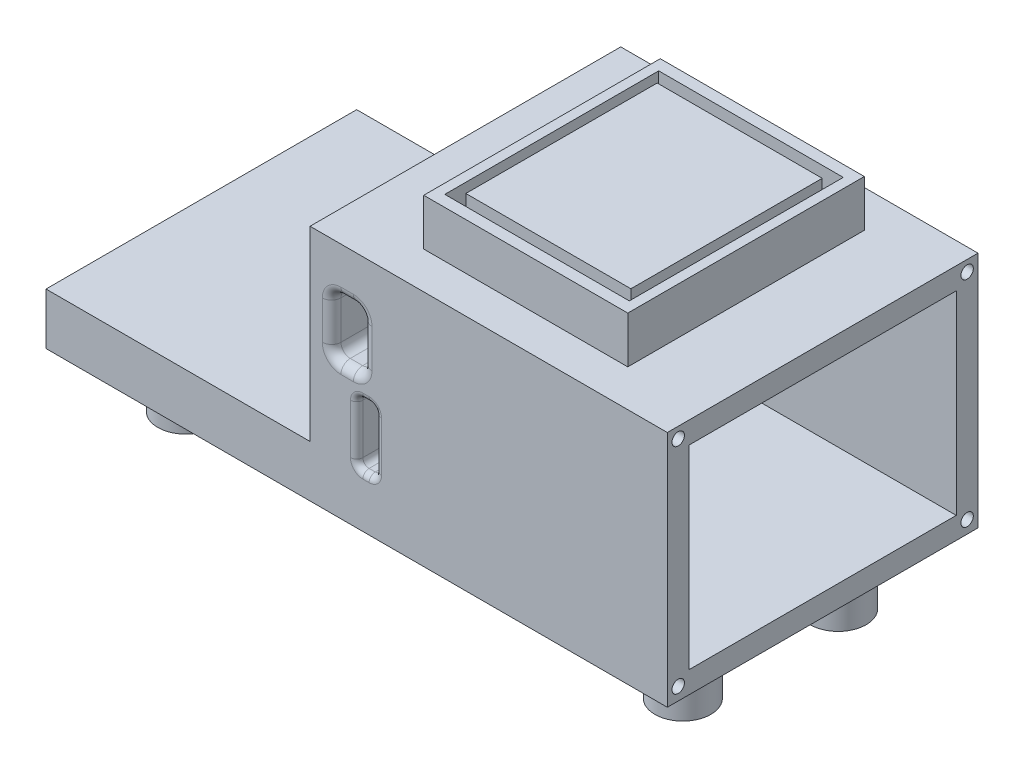
from build123d import *

# Parameters (mm, degrees)
SKETCH1_W            = 115
SKETCH1_H            = 100
BOSS_EXTRUDE1_DEPTH  = 40
SKETCH8_R            = 7
SKETCH8_R_2          = 6
BOSS_EXTRUDE4_DEPTH  = 20
SKETCH9_W            = 200
SKETCH9_H            = 100
BOSS_EXTRUDE5_DEPTH  = 16.6
SKETCH10_R           = 9
SKETCH10_R_2         = 10
BOSS_EXTRUDE7_DEPTH  = 20
SKETCH17_W           = 15
SKETCH17_H           = 100
BOSS_EXTRUDE15_DEPTH = 20
SKETCH15_R           = 14.1
CUT_EXTRUDE2_DEPTH   = 10
SKETCH21_R           = 1.76744544
SKETCH21_R_2         = 2.038433248
CUT_EXTRUDE3_DEPTH   = 20
SKETCH19_R           = 1.6
CUT_EXTRUDE4_DEPTH   = 23
CUT_EXTRUDE5_DEPTH   = 3
SKETCH28_W           = 94
SKETCH28_H           = 100
BOSS_EXTRUDE16_DEPTH = 20
SKETCH11_W           = 65.68
SKETCH11_H           = 76.14
SKETCH11_W_2         = 59.4
SKETCH11_H_2         = 68.859866018
SKETCH11_W_3         = 53.12
SKETCH11_H_3         = 61.579732034
BOSS_EXTRUDE17_DEPTH = 15
SKETCH30_W           = 86
SKETCH30_H           = 62.6
CUT_EXTRUDE10_DEPTH  = 89
SKETCH35_W           = 3
SKETCH35_H           = 15
SKETCH35_W_2         = 15
SKETCH35_H_2         = 3
CUT_EXTRUDE14_DEPTH  = 3
SKETCH36_W           = 10
SKETCH36_H           = 18.374860306
CUT_EXTRUDE15_DEPTH  = 168
SKETCH38_W           = 43.115865236
SKETCH38_H           = 20
BOSS_EXTRUDE18_DEPTH = 10
SKETCH39_W           = 36
SKETCH39_H           = 18.374860306
BOSS_EXTRUDE19_DEPTH = 10
CUT_EXTRUDE16_DEPTH  = 3
FILLET1_R            = 3
FILLET12_R           = 2
FILLET13_R           = 2
SKETCH41_R           = 2
CUT_EXTRUDE17_DEPTH  = 10


with BuildPart() as part:
    # Sketch1 → Boss-Extrude1 (new body)
    with BuildSketch(Plane(origin=(0, 0, 0), x_dir=(1, 0, 0), z_dir=(0, 1, 0))):
        Rectangle(SKETCH1_W, SKETCH1_H)
    extrude(amount=BOSS_EXTRUDE1_DEPTH)

    # Sketch8 → Boss-Extrude4 (add)
    with BuildSketch(Plane.XZ):
        with Locations(Location((0, 0, 0), (0, 0, 90))):
            Circle(SKETCH8_R)
        with Locations(Location((42.407889557, -36.876425702, 0), (0, 0, 90))):
            Circle(SKETCH8_R_2)
        with Locations(Location((42.407889557, 36.876425702, 0), (0, 0, 90))):
            Circle(SKETCH8_R_2)
    extrude(amount=BOSS_EXTRUDE4_DEPTH)

    # Sketch9 → Boss-Extrude5 (add)
    with BuildSketch(Plane.XZ.offset(20)):
        with Locations((-42.5, 0)):
            Rectangle(SKETCH9_W, SKETCH9_H)
    extrude(amount=BOSS_EXTRUDE5_DEPTH)

    # Sketch10 → Boss-Extrude7 (add)
    with BuildSketch(Plane.XZ.offset(36.6)):
        with Locations(Location((37.5, -25, 0), (0, 0, 270))):
            Circle(SKETCH10_R)
        with Locations(Location((-122.5, -25, 0), (0, 0, 90))):
            Circle(SKETCH10_R)
        with Locations(Location((-122.5, 25, 0), (0, 0, 270))):
            Circle(SKETCH10_R)
        with Locations(Location((37.5, 25, 0), (0, 0, 90))):
            Circle(SKETCH10_R)
        with Locations(Location((-42.5, 0, 0), (0, 0, 270))):
            Circle(SKETCH10_R_2)
    extrude(amount=BOSS_EXTRUDE7_DEPTH)

    # Sketch17 → Boss-Extrude15 (add)
    with BuildSketch(Plane.XZ):
        with Locations((-50, 0)):
            Rectangle(SKETCH17_W, SKETCH17_H)
    extrude(amount=BOSS_EXTRUDE15_DEPTH)

    # Sketch15 → Cut-Extrude2 (cut)
    with BuildSketch(Plane(origin=(0, -20, 0), x_dir=(1, 0, 0), z_dir=(0, 1, 0))):
        with Locations(Location((-78.6, 0, 0), (0, 0, 270))):
            Circle(SKETCH15_R)
    extrude(amount=-CUT_EXTRUDE2_DEPTH, mode=Mode.SUBTRACT)

    # Sketch21 → Cut-Extrude3 (cut)
    with BuildSketch(Plane(origin=(0, -30, 0), x_dir=(1, 0, 0), z_dir=(0, 1, 0))):
        with Locations(Location((-85.16065049, 0, 0), (0, 0, 270))):
            Circle(SKETCH21_R)
        with Locations(Location((-73.222056531, 0, 0), (0, 0, 270))):
            Circle(SKETCH21_R_2)
    extrude(amount=-CUT_EXTRUDE3_DEPTH, mode=Mode.SUBTRACT)

    # Sketch19 → Cut-Extrude4 (cut)
    with BuildSketch(Plane.ZY.offset(57.5)):
        with Locations((-32.14, -13.409140004)):
            Circle(SKETCH19_R)
        with Locations((32.14, -13.409140004)):
            Circle(SKETCH19_R)
        with Locations((-32.14, 14.690859996)):
            Circle(SKETCH19_R)
        with Locations(Location((32.14, 14.690859996, 0), (0, 0, 180))):
            Circle(SKETCH19_R)
    extrude(amount=-CUT_EXTRUDE4_DEPTH, mode=Mode.SUBTRACT)

    # Sketch22 → Cut-Extrude5 (cut)
    with BuildSketch(Plane(origin=(-42.5, 0, 0), x_dir=(0, 0, -1), z_dir=(1, 0, 0))):
        Polygon((-28.38722325, -13.409140004), (-30.263611625, -10.159140004), (-34.016388375, -10.159140004), (-35.89277675, -13.409140004), (-34.016388375, -16.659140004), (-30.263611625, -16.659140004), align=None)
        Polygon((30.263611625, -16.659140004), (28.38722325, -13.409140004), (30.263611625, -10.159140004), (34.016388375, -10.159140004), (35.89277675, -13.409140004), (34.016388375, -16.659140004), align=None)
    extrude(amount=-CUT_EXTRUDE5_DEPTH, mode=Mode.SUBTRACT)

    # Sketch28 → Boss-Extrude16 (add)
    with BuildSketch(Plane.XZ):
        with Locations((10.5, 0)):
            Rectangle(SKETCH28_W, SKETCH28_H)
    extrude(amount=BOSS_EXTRUDE16_DEPTH)

    # Sketch11 → Boss-Extrude17 (add)
    # profile 1 of 2: a face of its own
    with BuildSketch(Plane(origin=(0, 40, 0), x_dir=(1, 0, 0), z_dir=(0, 1, 0))):
        Rectangle(SKETCH11_W, SKETCH11_H)
        Rectangle(SKETCH11_W_2, SKETCH11_H_2, mode=Mode.SUBTRACT)
    # profile 2 of 2: a face of its own
    with BuildSketch(Plane(origin=(0, 40, 0), x_dir=(1, 0, 0), z_dir=(0, 1, 0))):
        Rectangle(SKETCH11_W_3, SKETCH11_H_3)
    extrude(amount=BOSS_EXTRUDE17_DEPTH)

    # Sketch30 → Cut-Extrude10 (cut)
    with BuildSketch(Plane(origin=(57.5, 0, 0), x_dir=(0, 0, -1), z_dir=(1, 0, 0))):
        with Locations((0, 1.7)):
            Rectangle(SKETCH30_W, SKETCH30_H)
    extrude(amount=-CUT_EXTRUDE10_DEPTH, mode=Mode.SUBTRACT)

    # Sketch35 → Cut-Extrude14 (cut)
    with BuildSketch(Plane(origin=(0, 40, 0), x_dir=(1, 0, 0), z_dir=(0, 1, 0))):
        with Locations((-28.2, -14.929933009)):
            Rectangle(SKETCH35_W, SKETCH35_H)
        with Locations((-28.2, 15.109933009)):
            Rectangle(SKETCH35_W, SKETCH35_H)
        with Locations((28.2, 15.109933009)):
            Rectangle(SKETCH35_W, SKETCH35_H)
        with Locations((28.2, -14.929933009)):
            Rectangle(SKETCH35_W, SKETCH35_H)
        with Locations((-15.2, -32.639866017)):
            Rectangle(SKETCH35_W_2, SKETCH35_H_2)
        with Locations((15.2, -32.639866017)):
            Rectangle(SKETCH35_W_2, SKETCH35_H_2)
        with Locations((15.2, 32.639866017)):
            Rectangle(SKETCH35_W_2, SKETCH35_H_2)
        with Locations((-15.2, 32.639866017)):
            Rectangle(SKETCH35_W_2, SKETCH35_H_2)
    extrude(amount=-CUT_EXTRUDE14_DEPTH, mode=Mode.SUBTRACT)

    # Sketch36 → Cut-Extrude15 (cut)
    with BuildSketch(Plane.XY.offset(50)):
        with Locations((-45.561490263, 15.812569847)):
            Rectangle(SKETCH36_W, SKETCH36_H)
    extrude(amount=-CUT_EXTRUDE15_DEPTH, mode=Mode.SUBTRACT)

    # Sketch38 → Boss-Extrude18 (add)
    with BuildSketch(Plane(origin=(-42.5, 0, 0), x_dir=(0, 0, -1), z_dir=(1, 0, 0))):
        with Locations((0, -10)):
            Rectangle(SKETCH38_W, SKETCH38_H)
    extrude(amount=BOSS_EXTRUDE18_DEPTH)

    # Sketch39 → Boss-Extrude19 (add)
    with BuildSketch(Plane(origin=(-50.561490263, 0, 0), x_dir=(0, 0, -1), z_dir=(1, 0, 0))):
        with Locations((0, 15.812569847)):
            Rectangle(SKETCH39_W, SKETCH39_H)
    extrude(amount=BOSS_EXTRUDE19_DEPTH)

    # Sketch40 → Cut-Extrude16 (cut)
    with BuildSketch(Plane(origin=(-50.561490263, 0, 0), x_dir=(0, 0, -1), z_dir=(1, 0, 0))):
        Polygon((34.016388375, 17.940859996), (30.263611625, 17.940859996), (28.38722325, 14.690859996), (30.263611625, 11.440859996), (34.016388375, 11.440859996), (35.89277675, 14.690859996), align=None)
        Polygon((-30.263611625, 17.940859996), (-34.016388375, 17.940859996), (-35.89277675, 14.690859996), (-34.016388375, 11.440859996), (-30.263611625, 11.440859996), (-28.38722325, 14.690859996), align=None)
    extrude(amount=-CUT_EXTRUDE16_DEPTH, mode=Mode.SUBTRACT)

    # Fillet1
    fillet1_edges = [part.edges().sort_by_distance(p)[0] for p in [
        (-45.561490263, 6.625139694, -50),
        (-45.561490263, 25, -50),
        (-50.561490263, 25, -34),
        (-40.561490263, 6.625139694, -34),
        (-50.561490263, 15.812569847, -50),
        (-50.561490263, 6.625139694, -34),
        (-40.561490263, 15.812569847, -50),
        (-40.561490263, 25, -34),
        (-50.561490263, 15.812569847, 50),
        (-45.561490263, 6.625139694, 50),
        (-40.561490263, 15.812569847, 50),
        (-45.561490263, 25, 50),
        (-40.561490263, 6.625139694, 34),
        (-40.561490263, 25, 34),
        (-50.561490263, 25, 34),
        (-50.561490263, 6.625139694, 34),
        (-50.561490263, 15.812569847, 18),
        (-45.561490263, 25, 18),
        (-45.561490263, 6.625139694, 18),
        (-50.561490263, 15.812569847, -18),
        (-45.561490263, 6.625139694, -18),
        (-45.561490263, 25, -18),
        (-40.561490263, 15.812569847, 18),
        (-40.561490263, 15.812569847, -18),
    ]]
    fillet(fillet1_edges, radius=FILLET1_R)

    # Fillet12
    fillet12_edges = [part.edges().sort_by_distance(p)[0] for p in [
        (-39.5, 0, -50),
        (-36.5, -10, -50),
        (-36.5, 0, -35.778966309),
        (-36.5, -20, -35.778966309),
        (-36.5, -10, -21.557932618),
        (-39.5, -20, -21.557932618),
        (-42.5, -10, -21.557932618),
        (-39.5, 0, -21.557932618),
        (-39.5, -20, -50),
        (-42.5, 0, -35.778966309),
        (-42.5, -10, -50),
        (-42.5, -20, -35.778966309),
    ]]
    fillet(fillet12_edges, radius=FILLET12_R)

    # Fillet13
    fillet13_edges = [part.edges().sort_by_distance(p)[0] for p in [
        (-39.5, -20, 50),
        (-36.5, -20, 35.778966309),
        (-36.5, 0, 35.778966309),
        (-36.5, -10, 50),
        (-36.5, -10, 21.557932618),
        (-42.5, 0, 35.778966309),
        (-42.5, -20, 35.778966309),
        (-39.5, 0, 21.557932618),
        (-42.5, -10, 21.557932618),
        (-39.5, -20, 21.557932618),
        (-39.5, 0, 50),
        (-42.5, -10, 50),
    ]]
    fillet(fillet13_edges, radius=FILLET13_R)

    # Sketch41 → Cut-Extrude17 (cut)
    with BuildSketch(Plane(origin=(57.5, 0, 0), x_dir=(0, 0, -1), z_dir=(1, 0, 0))):
        with Locations((-46.5, 36.5)):
            Circle(SKETCH41_R)
        with Locations(Location((-46.5, -32.5, 0), (0, 0, 180))):
            Circle(SKETCH41_R)
        with Locations(Location((46.5, 36.5, 0), (0, 0, 180))):
            Circle(SKETCH41_R)
        with Locations((46.5, -32.5)):
            Circle(SKETCH41_R)
    extrude(amount=-CUT_EXTRUDE17_DEPTH, mode=Mode.SUBTRACT)


solid = part.part
